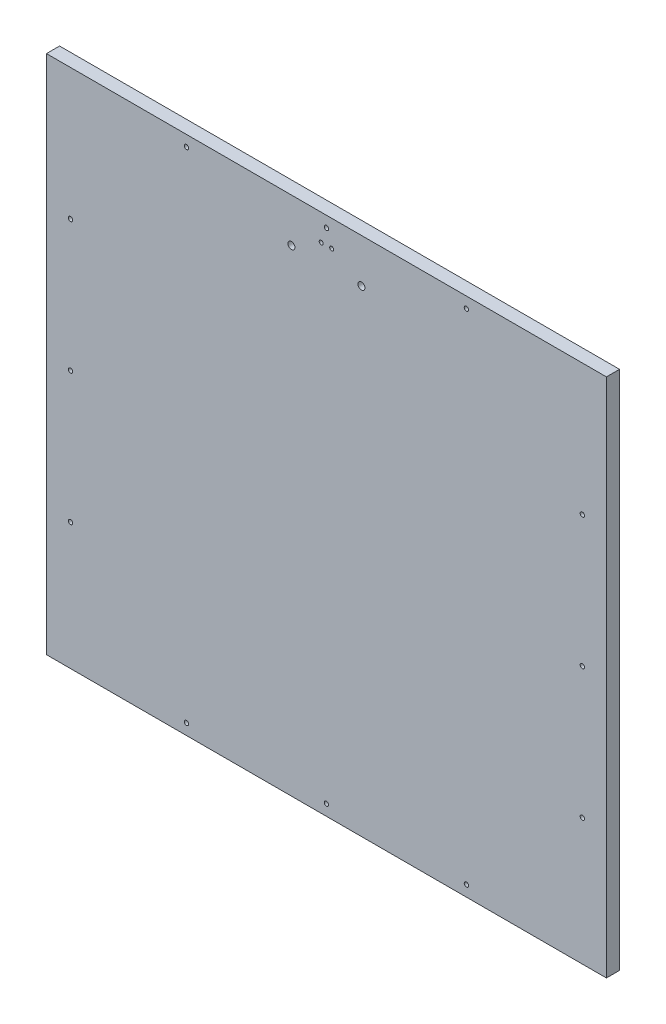
from build123d import *

# Parameters (mm, degrees)
SKETCH_1_W          = 640
SKETCH_1_H          = 595
EXTRUDE_1_DEPTH     = 15
SKETCH_2_R          = 2.5
CUT_EXTRUDE_1_DEPTH = 438.185601318
SKETCH_2_3_R        = 2.5
CUT_EXTRUDE_2_DEPTH = 438.185601318
SKETCH_3_R          = 4
CUT_EXTRUDE_3_DEPTH = 438.185601318
SKETCH_4_R          = 2.25
CUT_EXTRUDE_4_DEPTH = 438.185601318


with BuildPart() as part:
    # ｽｹｯﾁ1 → ﾎﾞｽ - 押し出し1 (new body)
    with BuildSketch(Plane.XY):
        Rectangle(SKETCH_1_W, SKETCH_1_H)
    extrude(amount=EXTRUDE_1_DEPTH)

    # ｽｹｯﾁ2 → ｶｯﾄ - 押し出し1 (cut, through all)
    with BuildSketch(Plane.XY.offset(15)):
        with Locations((-160, 285)):
            Circle(SKETCH_2_R)
        with Locations((0, 285)):
            Circle(SKETCH_2_R)
        with Locations((160, 285)):
            Circle(SKETCH_2_R)
    cut_extrude_1 = extrude(amount=-CUT_EXTRUDE_1_DEPTH, mode=Mode.SUBTRACT)

    # ｽｹｯﾁ2<3> → ｶｯﾄ - 押し出し2 (cut, through all)
    with BuildSketch(Plane.XY.offset(15)):
        with Locations((-292.5, 147.5)):
            Circle(SKETCH_2_3_R)
        with Locations((-292.5, -2.5)):
            Circle(SKETCH_2_3_R)
        with Locations((-292.5, -152.5)):
            Circle(SKETCH_2_3_R)
    cut_extrude_2 = extrude(amount=-CUT_EXTRUDE_2_DEPTH, mode=Mode.SUBTRACT)

    # ﾐﾗｰ1: ｶｯﾄ - 押し出し1 across plane
    add(cut_extrude_1.mirror(Plane.ZX), mode=Mode.SUBTRACT)

    # ﾐﾗｰ2: ｶｯﾄ - 押し出し2 across plane
    add(cut_extrude_2.mirror(Plane(origin=(0, 0, 0), x_dir=(0, 0, 1), z_dir=(1, 0, 0))), mode=Mode.SUBTRACT)

    # ｽｹｯﾁ3 → ｶｯﾄ - 押し出し3 (cut, through all)
    with BuildSketch(Plane(origin=(0, 0, 0), x_dir=(-1, 0, 0), z_dir=(0, 0, -1))):
        with Locations((-40, 247.5)):
            Circle(SKETCH_3_R)
        with Locations((40, 247.5)):
            Circle(SKETCH_3_R)
    extrude(amount=-CUT_EXTRUDE_3_DEPTH, mode=Mode.SUBTRACT)

    # ｽｹｯﾁ4 → ｶｯﾄ - 押し出し4 (cut, through all)
    with BuildSketch(Plane.XY.offset(15)):
        with Locations((6, 267.5)):
            Circle(SKETCH_4_R)
    cut_extrude_4 = extrude(amount=-CUT_EXTRUDE_4_DEPTH, mode=Mode.SUBTRACT)

    # ﾐﾗｰ3: ｶｯﾄ - 押し出し4 across plane
    add(cut_extrude_4.mirror(Plane(origin=(0, 0, 0), x_dir=(0, 0, 1), z_dir=(1, 0, 0))), mode=Mode.SUBTRACT)


solid = part.part
